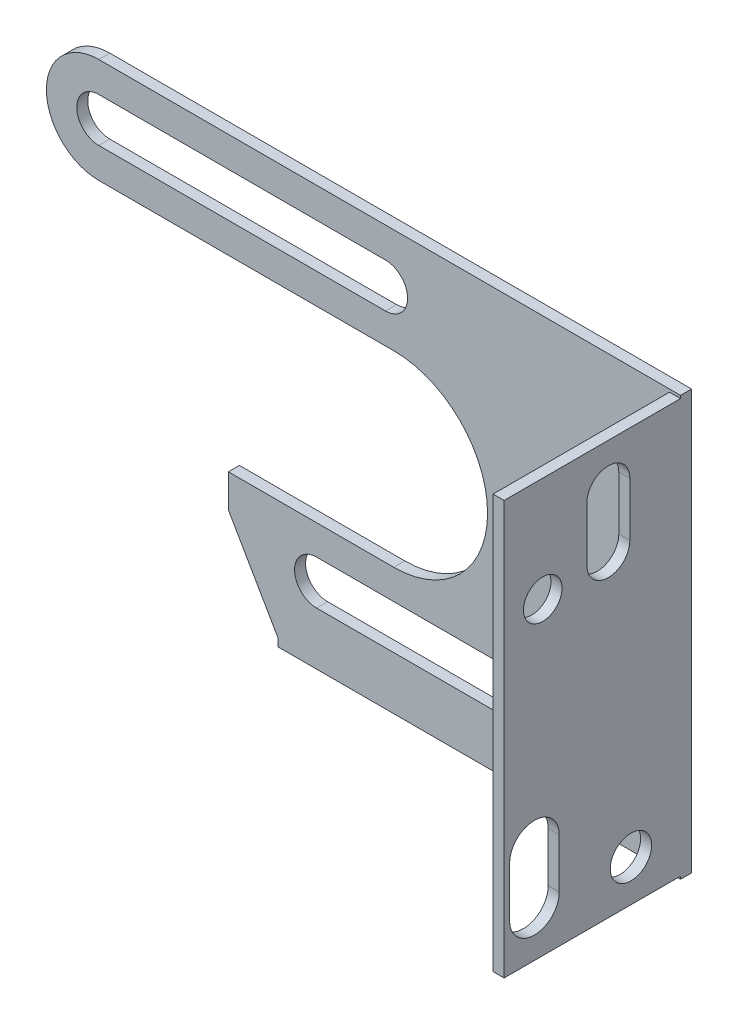
from build123d import *

# Parameters (mm, degrees)
SKETCH1_W           = 146.05
SKETCH1_H           = 101.6
BOSS_EXTRUDE1_DEPTH = 2.54
CUT_EXTRUDE1_DEPTH  = 178.931487095
SKETCH4_W           = 40.64
SKETCH4_H           = 95.25
SKETCH4_R           = 4.445
SKETCH4_R_2         = 4.7625
BOSS_EXTRUDE2_DEPTH = 2.54


with BuildPart() as part:
    # Sketch1 → Boss-Extrude1 (new body)
    with BuildSketch(Plane.XY):
        with Locations((73.025, -50.8)):
            Rectangle(SKETCH1_W, SKETCH1_H)
    extrude(amount=BOSS_EXTRUDE1_DEPTH)

    # Sketch2 → Cut-Extrude1 (cut, through all)
    with BuildSketch(Plane.XY):
        with BuildLine():
            Line((80.01, -72.39), (41.91, -72.39))
            Line((41.91, -72.39), (41.91, -80.01))
            Line((41.91, -80.01), (53.34, -99.807340731))
            Line((53.34, -99.807340731), (53.34, -101.6))
            Line((53.34, -101.6), (0, -101.6))
            Line((0, -101.6), (0, -29.21))
            Line((0, -29.21), (-13.136118413, -29.21))
            Line((-13.136118413, -29.21), (-13.136118413, 0))
            Line((-13.136118413, 0), (146.05, 0))
            Line((146.05, 0), (146.05, -5.08))
            Line((146.05, -5.08), (12.065, -5.08))
            ThreePointArc((12.065, -5.08), (0, -17.145), (12.065, -29.21))
            Line((12.065, -29.21), (80.01, -29.21))
            ThreePointArc((80.01, -29.21), (101.6, -50.8), (80.01, -72.39))
        make_face()
        with BuildLine():
            Line((12.065, -12.065), (78.105, -12.065))
            ThreePointArc((78.105, -12.065), (83.185, -17.145), (78.105, -22.225))
            Line((78.105, -22.225), (12.065, -22.225))
            ThreePointArc((12.065, -22.225), (6.985, -17.145), (12.065, -12.065))
        make_face()
        with BuildLine():
            Line((62.23, -79.248), (128.27, -79.248))
            ThreePointArc((128.27, -79.248), (133.35, -84.328), (128.27, -89.408))
            Line((128.27, -89.408), (62.23, -89.408))
            ThreePointArc((62.23, -89.408), (57.15, -84.328), (62.23, -79.248))
        make_face()
    extrude(amount=CUT_EXTRUDE1_DEPTH, mode=Mode.SUBTRACT)

    # Sketch4 → Boss-Extrude2 (add)
    with BuildSketch(Plane.ZY.offset(-146.05)):
        with Locations((22.86, -53.34)):
            Rectangle(SKETCH4_W, SKETCH4_H)
        with Locations((34.29, -29.845)):
            Circle(SKETCH4_R, mode=Mode.SUBTRACT)
        with Locations((13.97, -91.44)):
            Circle(SKETCH4_R_2, mode=Mode.SUBTRACT)
        with BuildLine():
            Line((24.13, -15.748), (24.13, -28.1559))
            ThreePointArc((24.13, -28.1559), (19.177, -33.1089), (14.224, -28.1559))
            Line((14.224, -28.1559), (14.224, -15.748))
            ThreePointArc((14.224, -15.748), (19.177, -10.795), (24.13, -15.748))
        make_face(mode=Mode.SUBTRACT)
        with BuildLine():
            Line((41.91, -78.74), (41.91, -90.17))
            ThreePointArc((41.91, -90.17), (36.195, -95.885), (30.48, -90.17))
            Line((30.48, -90.17), (30.48, -78.74))
            ThreePointArc((30.48, -78.74), (36.195, -73.025), (41.91, -78.74))
        make_face(mode=Mode.SUBTRACT)
    extrude(amount=BOSS_EXTRUDE2_DEPTH)


solid = part.part
